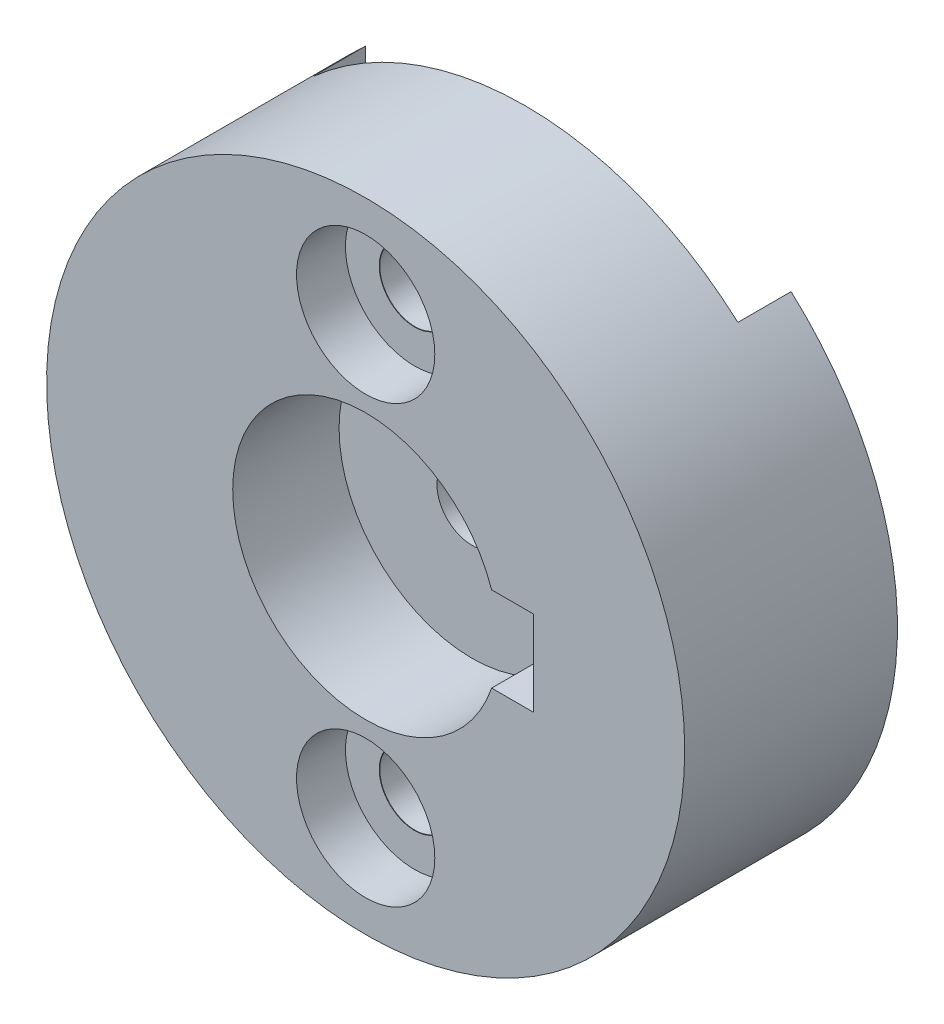
from build123d import *

# Parameters (mm, degrees)
ESQUISSE1_R                                  = 30
BOSS_EXTRU_1_DEPTH                           = 20
ESQUISSE2_W                                  = 40
ESQUISSE2_H                                  = 78.633630418
ENL_V_MAT_EXTRU_1_DEPTH                      = 5
ESQUISSE3_R                                  = 12.5
ENL_V_MAT_EXTRU_2_DEPTH                      = 10
D_GAGEMENT_M61_D                             = 6.6
CHAMBRAGE_POUR_VIS_T_TE_RONDE_BOMB_2_A_COUNT = 2
CHAMBRAGE_POUR_VIS_T_TE_RONDE_BOMB_2_A_PITCH = 41
ESQUISSE11_W                                 = 6
ESQUISSE11_H                                 = 8
ENL_V_MAT_EXTRU_8_DEPTH                      = 10


with BuildPart() as part:
    # Esquisse1 → Boss.-Extru.1 (new body)
    with BuildSketch(Plane.XY):
        Circle(ESQUISSE1_R)
    extrude(amount=BOSS_EXTRU_1_DEPTH)

    # Esquisse2 → Enlèv. mat.-Extru.1 (cut)
    with BuildSketch(Plane(origin=(0, 0, 0), x_dir=(-1, 0, 0), z_dir=(0, 0, -1))):
        Rectangle(ESQUISSE2_W, ESQUISSE2_H)
    extrude(amount=-ENL_V_MAT_EXTRU_1_DEPTH, mode=Mode.SUBTRACT)

    # Esquisse3 → Enlèv. mat.-Extru.2 (cut)
    with BuildSketch(Plane.XY.offset(20)):
        Circle(ESQUISSE3_R)
    extrude(amount=-ENL_V_MAT_EXTRU_2_DEPTH, mode=Mode.SUBTRACT)

    # Dégagement M61 (through all)
    with Locations(Plane.XY.offset(10)):
        with Locations((0, 0)):
            Hole(D_GAGEMENT_M61_D / 2)

    # Esquisse7 → Chambrage pour vis _ t_te ronde bomb_e M (revolve, cut)
    with BuildSketch(Plane(origin=(0, 0, 5), x_dir=(0, 1, 0), z_dir=(1, 0, 0))):
        Polygon((0, 0), (0, 15), (2.25, 15), (2.25, 3.125), (2.275, 3.1), (4.5, 3.1), (4.5, 0), align=None)
    revolve(axis=Axis((0, 0, -1.35), (0, 0, 1)), mode=Mode.SUBTRACT)

    # Esquisse9 → Chambrage pour vis _ t_te ronde bomb 2 (revolve, cut)
    with BuildSketch(Plane(origin=(0, -20.5, 20), x_dir=(0, -1, 0), z_dir=(1, 0, 0))):
        Polygon((0, 0), (0, 20), (3.3, 20), (3.3, 4.625), (3.325, 4.6), (6.5, 4.6), (6.5, 0), align=None)
    chambrage_pour_vis_t_te_ronde_bomb_2 = revolve(axis=Axis((0, -20.5, 26.35), (0, 0, -1)), mode=Mode.SUBTRACT)

    # Chambrage pour vis _ t_te ronde bomb 2 a: Chambrage pour vis _ t_te ronde bomb 2 ×2
    with Locations(*[(0, i * CHAMBRAGE_POUR_VIS_T_TE_RONDE_BOMB_2_A_PITCH, 0) for i in range(1, CHAMBRAGE_POUR_VIS_T_TE_RONDE_BOMB_2_A_COUNT)]):
        add(chambrage_pour_vis_t_te_ronde_bomb_2, mode=Mode.SUBTRACT)

    # Esquisse11 → Enlèv. mat.-Extru.8 (cut)
    with BuildSketch(Plane.XY.offset(20)):
        with Locations((12.8, 0)):
            Rectangle(ESQUISSE11_W, ESQUISSE11_H)
    extrude(amount=-ENL_V_MAT_EXTRU_8_DEPTH, mode=Mode.SUBTRACT)


solid = part.part
